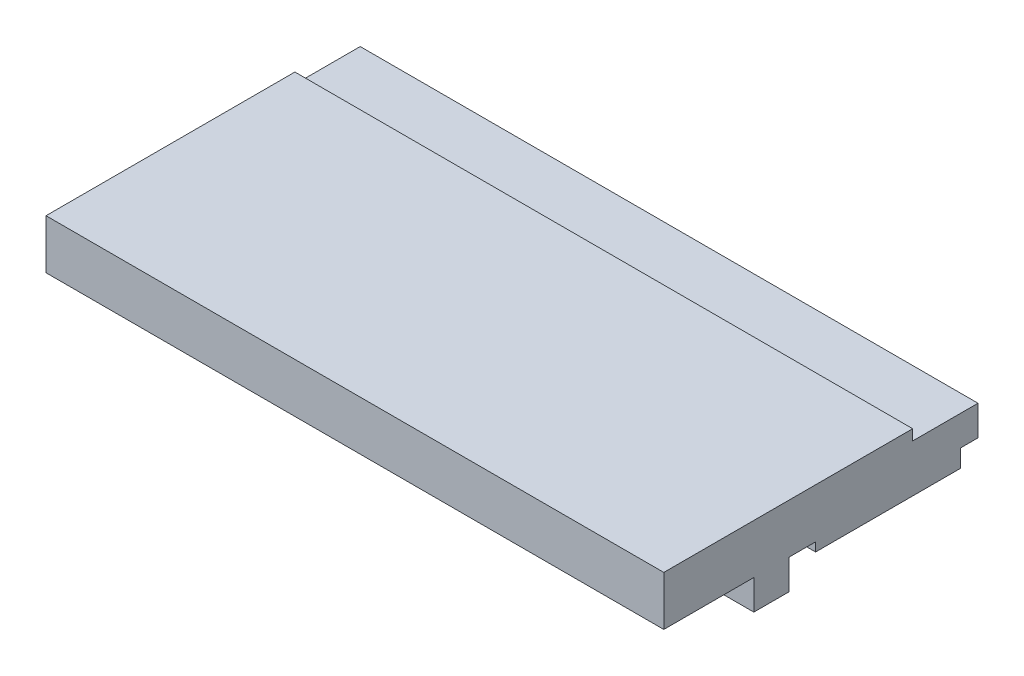
from build123d import *

# Parameters (mm, degrees)
BOSS_EXTRUDE1_DEPTH = 350


with BuildPart() as part:
    # Sketch2 → Boss-Extrude1 (new body)
    with BuildSketch(Plane(origin=(0, 0, 0), x_dir=(0, 0, -1), z_dir=(1, 0, 0))):
        Polygon((0, 0), (0, -17), (-10, -17), (-10, -27), (-92, -27), (-92, -22), (-107, -22), (-107, -39), (-127, -39), (-127, -22), (-178, -22), (-178, 6), (-37, 6), (-37, 0), align=None)
    extrude(amount=BOSS_EXTRUDE1_DEPTH)


solid = part.part
